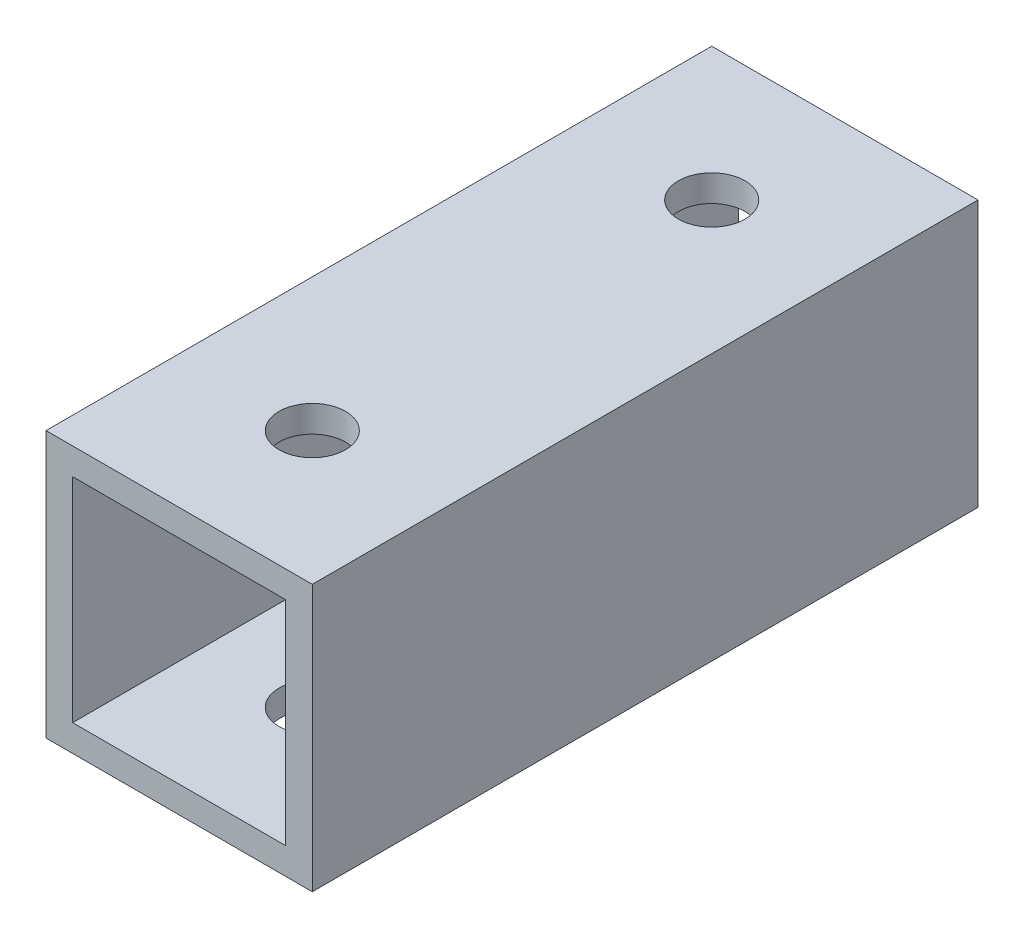
from build123d import *

# Parameters (mm, degrees)
SKETCH_1_W          = 20
SKETCH_1_H          = 20
SKETCH_1_W_2        = 16
SKETCH_1_H_2        = 16
EXTRUDE_1_DEPTH     = 50
CUT_EXTRUDE_1_REACH = 56.772
SKETCH_2_R          = 2.5


with BuildPart() as part:
    # 草图1 → 凸台-拉伸1 (new body)
    with BuildSketch(Plane.XY):
        Rectangle(SKETCH_1_W, SKETCH_1_H)
        Rectangle(SKETCH_1_W_2, SKETCH_1_H_2, mode=Mode.SUBTRACT)
    extrude(amount=EXTRUDE_1_DEPTH)

    # 切除-拉伸1: up to this face of the body (flat: up to its plane)
    cut_extrude_1_end = Plane(part.part.faces().sort_by_distance((0, -10, 25))[0])
    # 草图2 → 切除-拉伸1 (cut, up to the picked face)
    with BuildSketch(Plane(origin=(0, 10, 0), x_dir=(1, 0, 0), z_dir=(0, 1, 0)), mode=Mode.PRIVATE) as cut_extrude_1_sk1:
        with Locations(Location((0, -10, 0), (0, 0, 270))):
            Circle(SKETCH_2_R)
    cut_extrude_1_tool1 = split(extrude(cut_extrude_1_sk1.sketch, amount=-CUT_EXTRUDE_1_REACH, mode=Mode.PRIVATE), bisect_by=cut_extrude_1_end, keep=Keep.BOTH, mode=Mode.PRIVATE)
    # 草图2 → 切除-拉伸1 (cut, up to the picked face)
    with BuildSketch(Plane(origin=(0, 10, 0), x_dir=(1, 0, 0), z_dir=(0, 1, 0)), mode=Mode.PRIVATE) as cut_extrude_1_sk2:
        with Locations(Location((0, -40, 0), (0, 0, 270))):
            Circle(SKETCH_2_R)
    cut_extrude_1_tool2 = split(extrude(cut_extrude_1_sk2.sketch, amount=-CUT_EXTRUDE_1_REACH, mode=Mode.PRIVATE), bisect_by=cut_extrude_1_end, keep=Keep.BOTH, mode=Mode.PRIVATE)
    add(cut_extrude_1_tool1.solids().sort_by(Axis((0, 10, 10), (0, -1, 0)))[0], mode=Mode.SUBTRACT)
    add(cut_extrude_1_tool2.solids().sort_by(Axis((0, 10, 40), (0, -1, 0)))[0], mode=Mode.SUBTRACT)


solid = part.part
